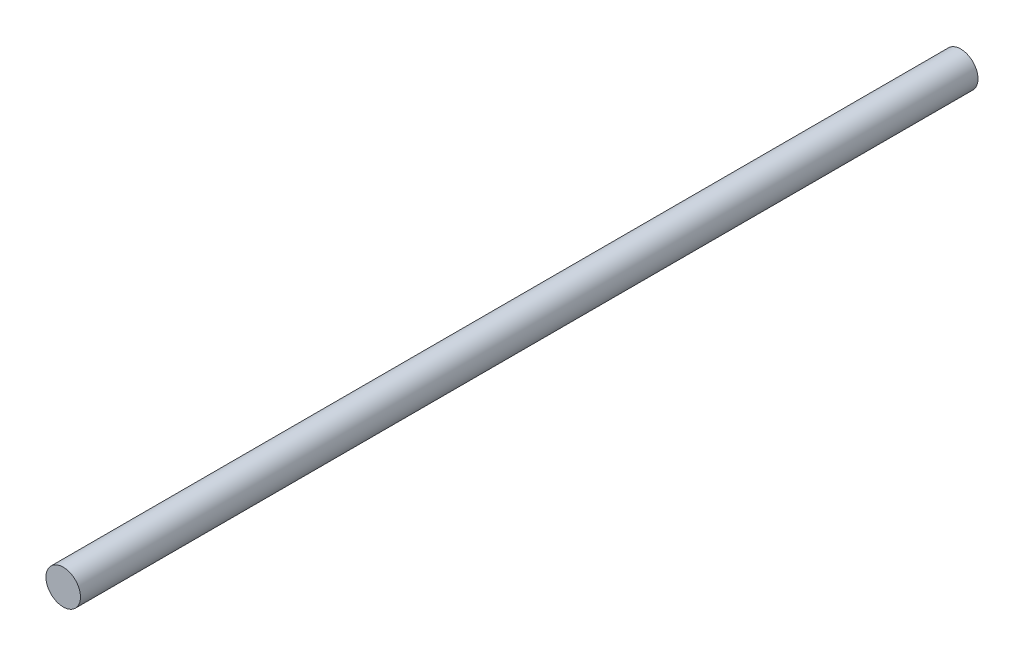
from build123d import *

# Parameters (mm, degrees)
SKETCH_7_R = 2.5


with BuildPart() as part:
    # 扫描3: sweep along a curve in space
    with BuildLine() as sweep_3_path:
        add(Edge.make_bspline(
            [(0, 0, 0), (0, 0, 130)],
            knots=[0, 0, 1, 1], degree=1))
    # 草图7 → 扫描3 (sweep)
    with BuildSketch(Plane.XY):
        Circle(SKETCH_7_R)
    sweep(path=sweep_3_path.line)


solid = part.part
